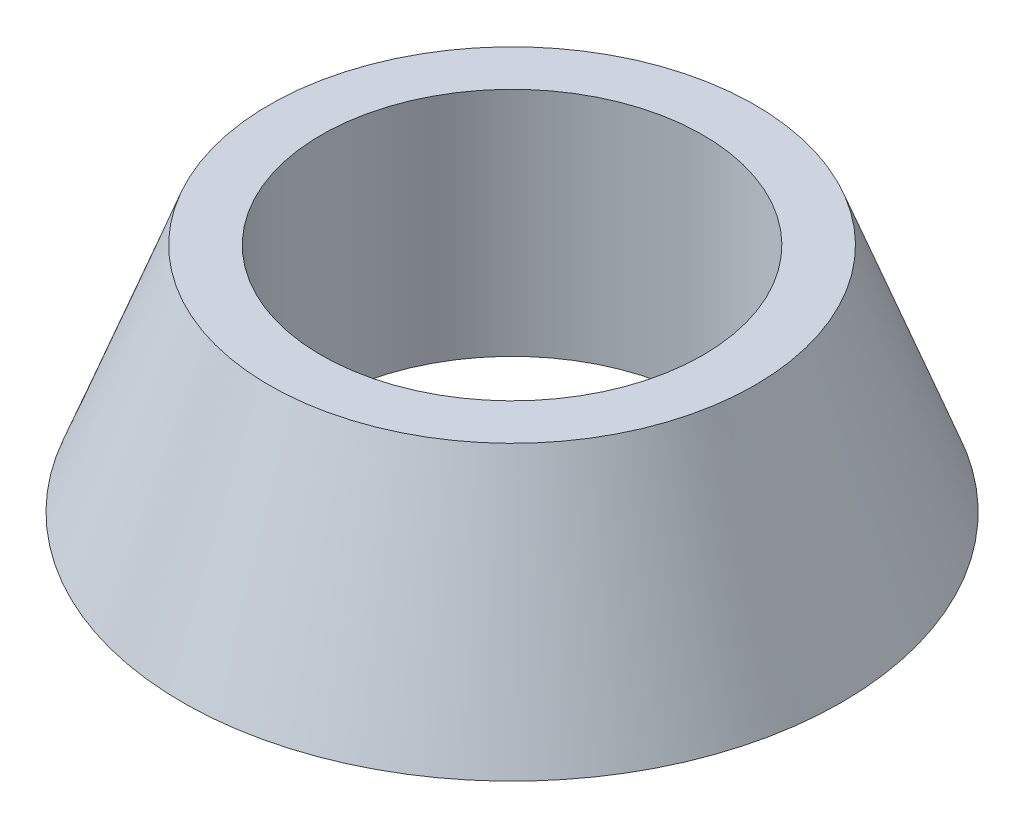
from build123d import *


with BuildPart() as part:
    # Sketch2 → Revolve1 (revolve)
    with BuildSketch(Plane.XY, mode=Mode.PRIVATE) as revolve1_sk:
        Polygon((-1.65, 2), (-2.1, 2), (-2.85, 0), (-1.65, 0), align=None)
    revolve(revolve1_sk.sketch.rotate(Axis((0, 0, 0), (0, 1, 0)), 180), axis=Axis((0, 0, 0), (0, 1, 0)))


solid = part.part
